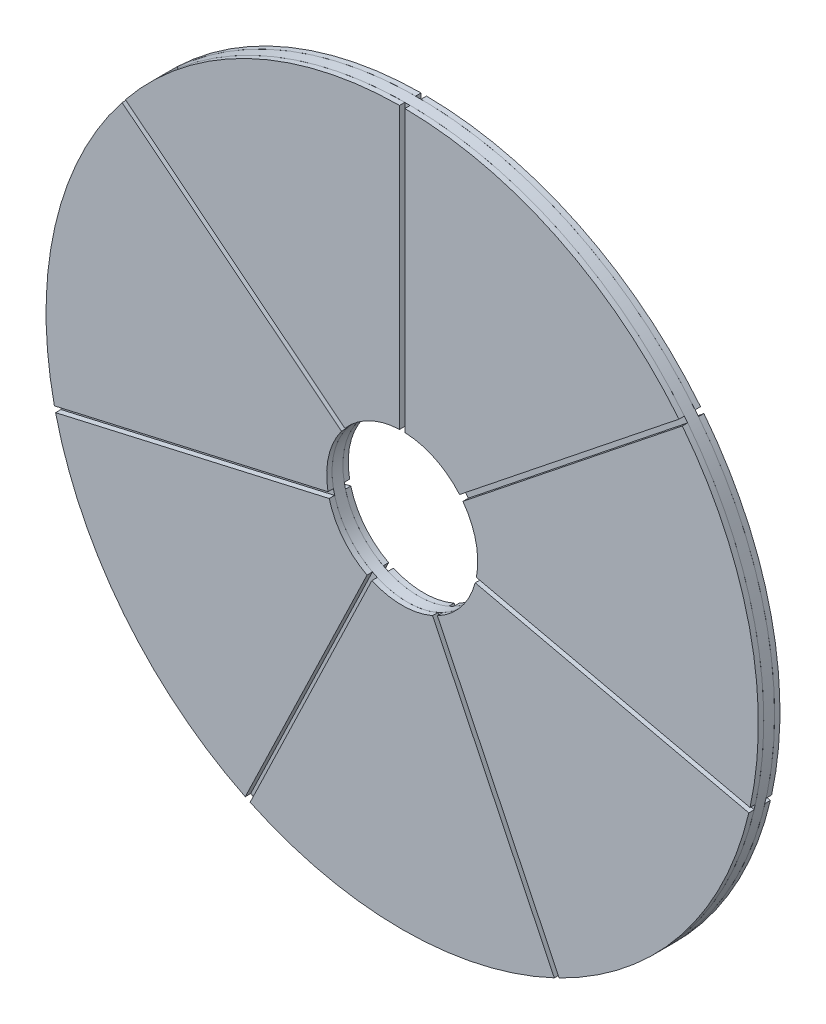
from build123d import *

# Parameters (mm, degrees)
BOSS_EXTRUDE1_DEPTH      = 0.25
BOSS_EXTRUDE1_DEPTH_BACK = 0.25
SKETCH1_R                = 16.5
BOSS_EXTRUDE2_DEPTH      = 0.25
BOSS_EXTRUDE2_2_DEPTH    = 0.25
BOSS_EXTRUDE2_3_DEPTH    = 0.25
BOSS_EXTRUDE2_4_DEPTH    = 0.25
BOSS_EXTRUDE2_5_DEPTH    = 0.25
BOSS_EXTRUDE2_6_DEPTH    = 0.25
BOSS_EXTRUDE2_7_DEPTH    = 0.25
CUT_EXTRUDE2_DEPTH       = 10
CUT_EXTRUDE2_DEPTH_BACK  = 8.35
SKETCH3_R                = 3.5


with BuildPart() as part:
    # Sketch1 → Boss-Extrude1 (new, two sides: drawn at the far end of the back side and taken through both)
    with BuildSketch(Plane.XY.offset(-BOSS_EXTRUDE1_DEPTH_BACK)):
        Circle(SKETCH1_R)
    extrude(amount=BOSS_EXTRUDE1_DEPTH + BOSS_EXTRUDE1_DEPTH_BACK)


with BuildPart() as body_2:
    # Sketch2 → Boss-Extrude2 (new body)
    with BuildSketch(Plane.XY.offset(0.25)):
        with BuildLine():
            Line((0.125, 16.499526508), (0.125, 0.259565175))
            Line((0.125, 0.259565175), (12.821913045, 10.385015449))
            ThreePointArc((12.821913045, 10.385015449), (7.159081695, 14.86598632), (0.125, 16.499526508))
        make_face()
    extrude(amount=BOSS_EXTRUDE2_DEPTH)


with BuildPart() as body_3:
    # Sketch2 → Boss-Extrude2 2 (new body)
    with BuildSketch(Plane.XY.offset(0.25)):
        with BuildLine():
            Line((-12.821913045, 10.385015449), (-0.125, 0.259565175))
            Line((-0.125, 0.259565175), (-0.125, 16.499526508))
            ThreePointArc((-0.125, 16.499526508), (-7.159081695, 14.86598632), (-12.821913045, 10.385015449))
        make_face()
    extrude(amount=BOSS_EXTRUDE2_2_DEPTH)


with BuildPart() as body_4:
    # Sketch2 → Boss-Extrude2 3 (new body)
    with BuildSketch(Plane.XY.offset(0.25)):
        with BuildLine():
            Line((-16.113664048, -3.549624059), (-0.28087245, 0.064107304))
            Line((-0.28087245, 0.064107304), (-12.977785495, 10.189557578))
            ThreePointArc((-12.977785495, 10.189557578), (-16.086310551, 3.67159541), (-16.113664048, -3.549624059))
        make_face()
    extrude(amount=BOSS_EXTRUDE2_3_DEPTH)


with BuildPart() as body_5:
    # Sketch2 → Boss-Extrude2 4 (new body)
    with BuildSketch(Plane.XY.offset(0.25)):
        with BuildLine():
            Line((12.977785495, 10.189557578), (0.28087245, 0.064107304))
            Line((0.28087245, 0.064107304), (16.113664048, -3.549624059))
            ThreePointArc((16.113664048, -3.549624059), (16.086310551, 3.67159541), (12.977785495, 10.189557578))
        make_face()
    extrude(amount=BOSS_EXTRUDE2_4_DEPTH)


with BuildPart() as body_6:
    # Sketch2 → Boss-Extrude2 5 (new body)
    with BuildSketch(Plane.XY.offset(0.25)):
        with BuildLine():
            Line((16.058033814, -3.793356037), (0.225242217, -0.179624674))
            Line((0.225242217, -0.179624674), (7.271497364, -14.811324252))
            ThreePointArc((7.271497364, -14.811324252), (12.900219461, -10.287581731), (16.058033814, -3.793356037))
        make_face()
    extrude(amount=BOSS_EXTRUDE2_5_DEPTH)


with BuildPart() as body_7:
    # Sketch2 → Boss-Extrude2 6 (new body)
    with BuildSketch(Plane.XY.offset(0.25)):
        with BuildLine():
            Line((7.046255147, -14.919795187), (0, -0.288095609))
            Line((0, -0.288095609), (-7.046255147, -14.919795187))
            ThreePointArc((-7.046255147, -14.919795187), (0, -16.5), (7.046255147, -14.919795187))
        make_face()
    extrude(amount=BOSS_EXTRUDE2_6_DEPTH)


with BuildPart() as body_8:
    # Sketch2 → Boss-Extrude2 7 (new body)
    with BuildSketch(Plane.XY.offset(0.25)):
        with BuildLine():
            Line((-7.271497364, -14.811324252), (-0.225242217, -0.179624674))
            Line((-0.225242217, -0.179624674), (-16.058033814, -3.793356037))
            ThreePointArc((-16.058033814, -3.793356037), (-12.900219461, -10.287581731), (-7.271497364, -14.811324252))
        make_face()
    extrude(amount=BOSS_EXTRUDE2_7_DEPTH)


with BuildPart() as body_9:
    # Mirror5: mirrored copy
    add(body_2.part.mirror(Plane.XY))


with BuildPart() as body_10:
    # Mirror5 2: mirrored copy
    add(body_3.part.mirror(Plane.XY))


with BuildPart() as body_11:
    # Mirror5 3: mirrored copy
    add(body_5.part.mirror(Plane.XY))


with BuildPart() as body_12:
    # Mirror5 4: mirrored copy
    add(body_6.part.mirror(Plane.XY))


with BuildPart() as body_13:
    # Mirror5 5: mirrored copy
    add(body_7.part.mirror(Plane.XY))


with BuildPart() as body_14:
    # Mirror5 6: mirrored copy
    add(body_8.part.mirror(Plane.XY))


with BuildPart() as body_15:
    # Mirror5 7: mirrored copy
    add(body_4.part.mirror(Plane.XY))


with BuildPart() as cut_extrude2_tool:
    # Sketch3 → Cut-Extrude2 (new, two sides: drawn at the far end of the back side and taken through both)
    with BuildSketch(Plane.XY.offset(-CUT_EXTRUDE2_DEPTH_BACK)):
        Circle(SKETCH3_R)
    extrude(amount=CUT_EXTRUDE2_DEPTH + CUT_EXTRUDE2_DEPTH_BACK)


with BuildPart() as part_1:
    add(part.part)

    # Cut-Extrude2: cut by cut_extrude2_tool
    add(cut_extrude2_tool.part, mode=Mode.SUBTRACT)


with BuildPart() as body_2_1:
    add(body_2.part)

    # Cut-Extrude2: cut by cut_extrude2_tool
    add(cut_extrude2_tool.part, mode=Mode.SUBTRACT)


with BuildPart() as body_3_1:
    add(body_3.part)

    # Cut-Extrude2: cut by cut_extrude2_tool
    add(cut_extrude2_tool.part, mode=Mode.SUBTRACT)


with BuildPart() as body_4_1:
    add(body_4.part)

    # Cut-Extrude2: cut by cut_extrude2_tool
    add(cut_extrude2_tool.part, mode=Mode.SUBTRACT)


with BuildPart() as body_5_1:
    add(body_5.part)

    # Cut-Extrude2: cut by cut_extrude2_tool
    add(cut_extrude2_tool.part, mode=Mode.SUBTRACT)


with BuildPart() as body_6_1:
    add(body_6.part)

    # Cut-Extrude2: cut by cut_extrude2_tool
    add(cut_extrude2_tool.part, mode=Mode.SUBTRACT)


with BuildPart() as body_7_1:
    add(body_7.part)

    # Cut-Extrude2: cut by cut_extrude2_tool
    add(cut_extrude2_tool.part, mode=Mode.SUBTRACT)


with BuildPart() as body_8_1:
    add(body_8.part)

    # Cut-Extrude2: cut by cut_extrude2_tool
    add(cut_extrude2_tool.part, mode=Mode.SUBTRACT)


with BuildPart() as body_9_1:
    add(body_9.part)

    # Cut-Extrude2: cut by cut_extrude2_tool
    add(cut_extrude2_tool.part, mode=Mode.SUBTRACT)


with BuildPart() as body_10_1:
    add(body_10.part)

    # Cut-Extrude2: cut by cut_extrude2_tool
    add(cut_extrude2_tool.part, mode=Mode.SUBTRACT)


with BuildPart() as body_11_1:
    add(body_11.part)

    # Cut-Extrude2: cut by cut_extrude2_tool
    add(cut_extrude2_tool.part, mode=Mode.SUBTRACT)


with BuildPart() as body_12_1:
    add(body_12.part)

    # Cut-Extrude2: cut by cut_extrude2_tool
    add(cut_extrude2_tool.part, mode=Mode.SUBTRACT)


with BuildPart() as body_13_1:
    add(body_13.part)

    # Cut-Extrude2: cut by cut_extrude2_tool
    add(cut_extrude2_tool.part, mode=Mode.SUBTRACT)


with BuildPart() as body_14_1:
    add(body_14.part)

    # Cut-Extrude2: cut by cut_extrude2_tool
    add(cut_extrude2_tool.part, mode=Mode.SUBTRACT)


with BuildPart() as body_15_1:
    add(body_15.part)

    # Cut-Extrude2: cut by cut_extrude2_tool
    add(cut_extrude2_tool.part, mode=Mode.SUBTRACT)


solid = Compound([part_1.part, body_2_1.part, body_3_1.part, body_4_1.part, body_5_1.part, body_6_1.part, body_7_1.part, body_8_1.part, body_9_1.part, body_10_1.part, body_11_1.part, body_12_1.part, body_13_1.part, body_14_1.part, body_15_1.part])
